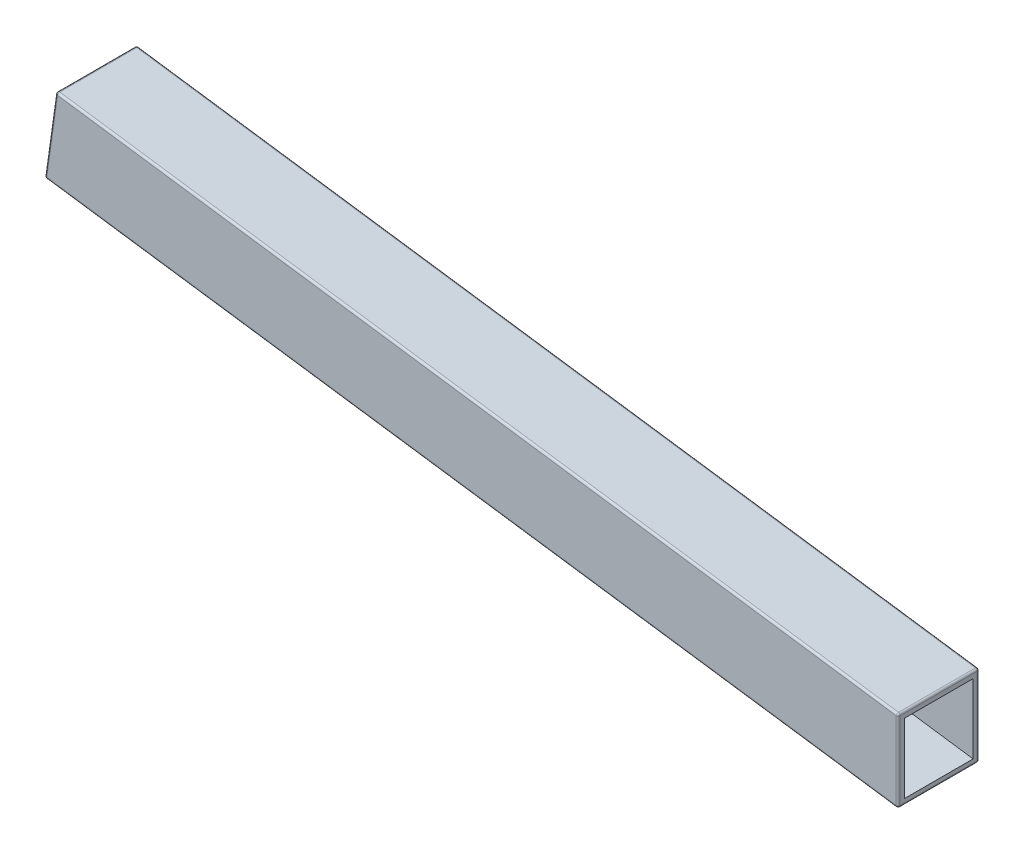
from build123d import *

# Parameters (mm, degrees)
BOSS_EXTRUDE1_DEPTH = 40
SKETCH2_W           = 34
SKETCH2_H           = 34
CUT_EXTRUDE1_DEPTH  = 428.497105029
FILLET1_R           = 1


with BuildPart() as part:
    # Sketch1 → Boss-Extrude1 (new body)
    with BuildSketch(Plane.XY):
        Polygon((0, 0), (-421.47951291, 59.235082554), (-415.912588871, 98.845805304), (0, 40.393102901), align=None)
    extrude(amount=BOSS_EXTRUDE1_DEPTH)

    # Sketch2 → Cut-Extrude1 (cut, through all)
    with BuildSketch(Plane(origin=(-421.47951291, 59.235082554, 0), x_dir=(0, 0, 1), z_dir=(-0.9902680687415704, 0.13917310096006613, 0))):
        with Locations((20, 20)):
            Rectangle(SKETCH2_W, SKETCH2_H)
    extrude(amount=-CUT_EXTRUDE1_DEPTH, mode=Mode.SUBTRACT)

    # Fillet1
    fillet1_edges = [part.edges().sort_by_distance(p)[0] for p in [
        (-418.696050891, 79.040443929, 40),
        (-210.739756455, 29.617541277, 40),
        (0, 20.19655145, 40),
        (-210.739756455, 29.617541277, 0),
        (-418.696050891, 79.040443929, 0),
        (-207.956294436, 69.619454102, 0),
        (0, 20.19655145, 0),
        (-207.956294436, 69.619454102, 40),
        (0, 0, 20),
        (-421.47951291, 59.235082554, 20),
        (-415.912588871, 98.845805304, 20),
        (0, 40.393102901, 20),
    ]]
    fillet(fillet1_edges, radius=FILLET1_R)


solid = part.part
